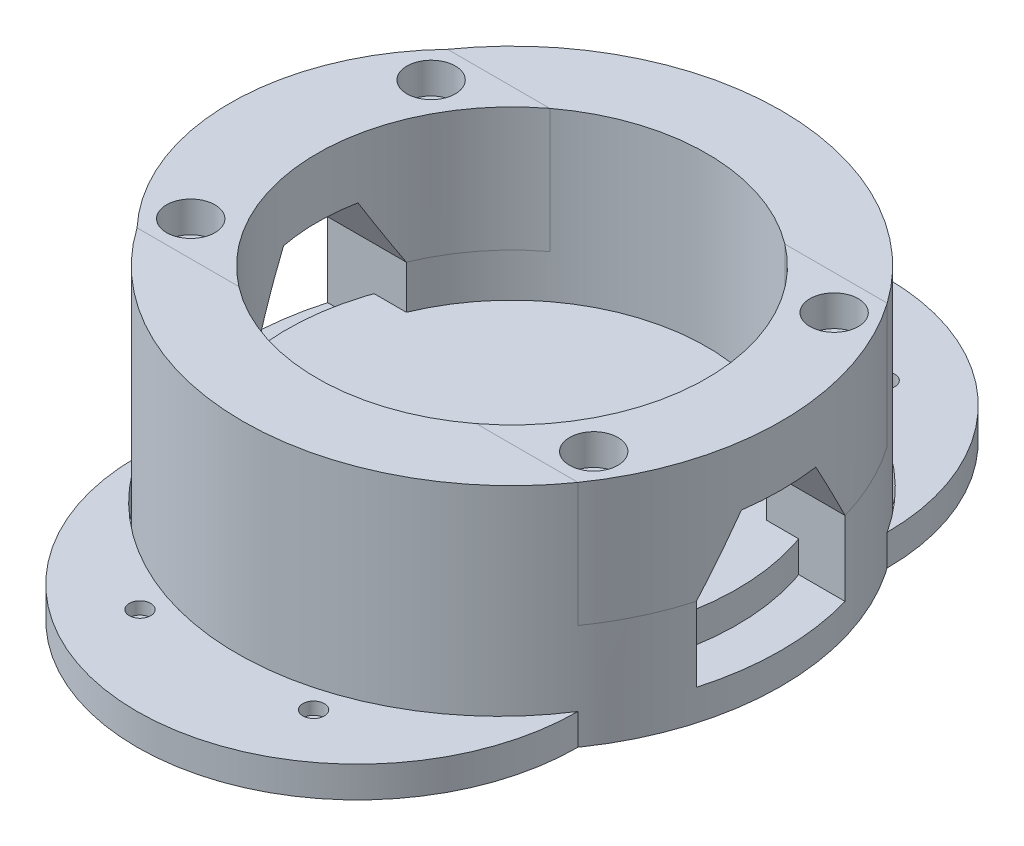
from build123d import *
from build123d.topology import SkipClean

# Parameters (mm, degrees)
SKETCH1_R               = 55.1434
SKETCH1_R_2             = 39.9034
BOSS_EXTRUDE1_DEPTH     = 40.64
CUT_EXTRUDE2_DEPTH      = 88.938607717
CUT_EXTRUDE2_DEPTH_BACK = 88.938607717
SKETCH7_R               = 46.101
BOSS_EXTRUDE2_DEPTH     = 6.35
BOSS_EXTRUDE4_DEPTH     = 25.4
BOSS_EXTRUDE6_DEPTH     = 25.4
CUT_EXTRUDE3_DEPTH      = 76.2
CUT_EXTRUDE3_DEPTH_BACK = 76.2
BOSS_EXTRUDE9_DEPTH     = 6.35
BOSS_EXTRUDE9_2_DEPTH   = 6.35
SKETCH1_4_R             = 55.1434
BOSS_EXTRUDE10_DEPTH    = 6.35
SKETCH21_R              = 3.2004
CUT_EXTRUDE4_DEPTH      = 8.89
SKETCH22_R              = 2.1971
SKETCH22_R_2            = 2.2225
CUT_EXTRUDE5_DEPTH      = 2.54
SKETCH27_R              = 4.953
CUT_EXTRUDE6_DEPTH      = 6.35


with BuildPart() as part:
    # Sketch1 → Boss-Extrude1 (new body)
    with BuildSketch(Plane(origin=(0, 0, 0), x_dir=(1, 0, 0), z_dir=(0, 1, 0))):
        with Locations(Location((0, 0, 0), (0, 0, 270))):
            Circle(SKETCH1_R)
        with Locations(Location((0, 0, 0), (0, 0, 270))):
            Circle(SKETCH1_R_2, mode=Mode.SUBTRACT)
    extrude(amount=BOSS_EXTRUDE1_DEPTH)

    # Sketch6 → Cut-Extrude2 (cut, two sides: drawn at the far end of the back side and taken through both)
    with BuildSketch(Plane(origin=(0, 0, 0), x_dir=(0, 0, -1), z_dir=(1, 0, 0)).offset(-CUT_EXTRUDE2_DEPTH_BACK)):
        Polygon((-31.644965026, 242.624199171), (-31.644965026, 40.64), (-31.644965026, 15.24), (-15.24, 15.24), (-15.24, 0), (15.24, 0), (15.24, 15.24), (31.821383578, 15.24), (31.821383578, 40.64), (31.821383578, 242.624199171), (31.821383578, 646.592597512), (-31.644965026, 646.592597512), align=None)
    extrude(amount=CUT_EXTRUDE2_DEPTH + CUT_EXTRUDE2_DEPTH_BACK, mode=Mode.SUBTRACT)


with BuildPart() as cut_extrude2_piece_1:
    # of the separate pieces the step leaves, piece 1, a body of its own (cut_extrude2_pieces)
    add(part.part.solids().sort_by_distance((-52.995631552, 0, 15.24))[0])



with BuildPart() as cut_extrude2_piece_2:
    # of the separate pieces the step leaves, piece 2, a body of its own (cut_extrude2_pieces)
    add(part.part.solids().sort_by_distance((52.995631552, 0, -15.24))[0])


with BuildPart() as body_3:
    # Sketch7 → Boss-Extrude2 (new body)
    with BuildSketch(Plane(origin=(0, 0, 0), x_dir=(1, 0, 0), z_dir=(0, 1, 0))):
        with Locations(Location((0, 0, 0), (0, 0, 270))):
            Circle(SKETCH7_R)
    extrude(amount=BOSS_EXTRUDE2_DEPTH)


with BuildPart() as body_4:
    # Sketch8 → Boss-Extrude4 (new body)
    with BuildSketch(Plane(origin=(0, 15.24, 0), x_dir=(1, 0, 0), z_dir=(0, 1, 0))):
        with BuildLine():
            Line((45.159614171, -31.644965026), (24.307972356, -31.644965026))
            ThreePointArc((24.307972356, -31.644965026), (39.903134753, 0.145493869), (24.076562851, 31.821383578))
            Line((24.076562851, 31.821383578), (45.035476135, 31.821383578))
            ThreePointArc((45.035476135, 31.821383578), (55.143294516, 0.107858423), (45.159614171, -31.644965026))
        make_face()
    extrude(amount=BOSS_EXTRUDE4_DEPTH)


with BuildPart() as body_5:
    # Sketch11 → Boss-Extrude6 (new body)
    with BuildSketch(Plane(origin=(0, 15.24, 0), x_dir=(1, 0, 0), z_dir=(0, 1, 0))):
        with BuildLine():
            Line((-45.035476135, 31.821383578), (-24.076562851, 31.821383578))
            ThreePointArc((-24.076562851, 31.821383578), (-31.585051519, 24.385771509), (-36.878499584, 15.24))
            ThreePointArc((-36.878499584, 15.24), (-38.542133743, -10.333695277), (-24.307972356, -31.644965026))
            Line((-24.307972356, -31.644965026), (-45.159614171, -31.644965026))
            ThreePointArc((-45.159614171, -31.644965026), (-57.766312197, 0.112988957), (-45.035476135, 31.821383578))
        make_face()
    extrude(amount=BOSS_EXTRUDE6_DEPTH)


with BuildPart() as cut_extrude3_tool:
    # Sketch12 → Cut-Extrude3 (new, two sides: drawn at the far end of the back side and taken through both)
    with BuildSketch(Plane(origin=(0, 0, 0), x_dir=(0, 0, -1), z_dir=(1, 0, 0)).offset(-CUT_EXTRUDE3_DEPTH_BACK)):
        Polygon((-15.24, 15.24), (-7.62, 28.438227154), (7.62, 28.438227154), (15.24, 15.24), align=None)
    extrude(amount=CUT_EXTRUDE3_DEPTH + CUT_EXTRUDE3_DEPTH_BACK)


with BuildPart() as body_4_1:
    add(body_4.part)

    # Cut-Extrude3: cut by cut_extrude3_tool
    add(cut_extrude3_tool.part, mode=Mode.SUBTRACT)


with BuildPart() as body_5_1:
    add(body_5.part)

    # Cut-Extrude3: cut by cut_extrude3_tool
    add(cut_extrude3_tool.part, mode=Mode.SUBTRACT)


with BuildPart() as body_6:
    # Sketch16 → Boss-Extrude9 (new body)
    with BuildSketch(Plane(origin=(0, 0, 0), x_dir=(1, 0, 0), z_dir=(0, 1, 0))):
        with BuildLine():
            ThreePointArc((-45.035476135, 31.821383578), (0, 76.856859713), (45.035476135, 31.821383578))
            ThreePointArc((45.035476135, 31.821383578), (0, 56.274479887), (-45.035476135, 31.821383578))
        make_face()
    extrude(amount=-BOSS_EXTRUDE9_DEPTH)


with BuildPart() as body_7:
    # Sketch16 → Boss-Extrude9 2 (new body)
    with BuildSketch(Plane(origin=(0, 0, 0), x_dir=(1, 0, 0), z_dir=(0, 1, 0))):
        with BuildLine():
            ThreePointArc((-45.159614171, -31.644965026), (0, -76.804579197), (45.159614171, -31.644965026))
            ThreePointArc((45.159614171, -31.644965026), (0, -56.290123178), (-45.159614171, -31.644965026))
        make_face()
    extrude(amount=-BOSS_EXTRUDE9_2_DEPTH)


with BuildPart() as cut_extrude2_piece_1_1:
    with SkipClean():  # the faces are left unmerged after this step: merging them gives an invalid solid
        add(cut_extrude2_piece_1.part)

        add(cut_extrude2_piece_2.part)  # Boss-Extrude10 merges Cut-Extrude2 piece 2
        # Sketch1<4> → Boss-Extrude10 (add)
        with BuildSketch(Plane(origin=(0, 0, 0), x_dir=(1, 0, 0), z_dir=(0, 1, 0))):
            with Locations(Location((0, 0, 0), (0, 0, 144.755552859))):
                Circle(SKETCH1_4_R)
        extrude(amount=-BOSS_EXTRUDE10_DEPTH)


with BuildPart() as cut_extrude4_tool:
    # Sketch21 → Cut-Extrude4 (new body)
    with BuildSketch(Plane(origin=(0, 40.64, 0), x_dir=(1, 0, 0), z_dir=(0, 1, 0))):
        with Locations(Location((-41.275, 24.709383578, 0), (0, 0, 270))):
            Circle(SKETCH21_R)
        with Locations(Location((-41.275, -24.532965026, 0), (0, 0, 270))):
            Circle(SKETCH21_R)
        with Locations(Location((41.275, -24.532965026, 0), (0, 0, 270))):
            Circle(SKETCH21_R)
        with Locations(Location((41.275, 24.709383578, 0), (0, 0, 270))):
            Circle(SKETCH21_R)
    extrude(amount=-CUT_EXTRUDE4_DEPTH)


with BuildPart() as body_4_2:
    add(body_4_1.part)

    # Cut-Extrude4: cut by cut_extrude4_tool
    add(cut_extrude4_tool.part, mode=Mode.SUBTRACT)


with BuildPart() as body_5_2:
    add(body_5_1.part)

    # Cut-Extrude4: cut by cut_extrude4_tool
    add(cut_extrude4_tool.part, mode=Mode.SUBTRACT)


with BuildPart() as cut_extrude5_tool:
    # Sketch22 → Cut-Extrude5 (new body)
    with BuildSketch(Plane(origin=(0, 0, 0), x_dir=(1, 0, 0), z_dir=(0, 1, 0))):
        with Locations(Location((17.78, -58.42, 0), (0, 0, 270))):
            Circle(SKETCH22_R)
        with Locations(Location((-17.78, -58.42, 0), (0, 0, 270))):
            Circle(SKETCH22_R)
        with Locations(Location((-17.78, 58.42, 0), (0, 0, 270))):
            Circle(SKETCH22_R_2)
        with Locations(Location((17.78, 58.42, 0), (0, 0, 270))):
            Circle(SKETCH22_R_2)
    extrude(amount=-CUT_EXTRUDE5_DEPTH)


with BuildPart() as body_6_1:
    add(body_6.part)

    # Cut-Extrude5: cut by cut_extrude5_tool
    add(cut_extrude5_tool.part, mode=Mode.SUBTRACT)


with BuildPart() as body_7_1:
    add(body_7.part)

    # Cut-Extrude5: cut by cut_extrude5_tool
    add(cut_extrude5_tool.part, mode=Mode.SUBTRACT)


with BuildPart() as cut_extrude6_tool:
    # Sketch27 → Cut-Extrude6 (new body)
    with BuildSketch(Plane(origin=(0, 40.64, 0), x_dir=(1, 0, 0), z_dir=(0, 1, 0))):
        with Locations(Location((-41.275, 24.709383578, 0), (0, 0, 270))):
            Circle(SKETCH27_R)
        with Locations(Location((-41.275, -24.532965026, 0), (0, 0, 270))):
            Circle(SKETCH27_R)
        with Locations(Location((41.275, -24.532965026, 0), (0, 0, 270))):
            Circle(SKETCH27_R)
        with Locations(Location((41.275, 24.709383578, 0), (0, 0, 270))):
            Circle(SKETCH27_R)
    extrude(amount=-CUT_EXTRUDE6_DEPTH)


with BuildPart() as body_4_3:
    add(body_4_2.part)

    # Cut-Extrude6: cut by cut_extrude6_tool
    add(cut_extrude6_tool.part, mode=Mode.SUBTRACT)


with BuildPart() as body_5_3:
    add(body_5_2.part)

    # Cut-Extrude6: cut by cut_extrude6_tool
    add(cut_extrude6_tool.part, mode=Mode.SUBTRACT)


solid = Compound([body_3.part, cut_extrude2_piece_1_1.part, body_6_1.part, body_7_1.part, body_4_3.part, body_5_3.part])
